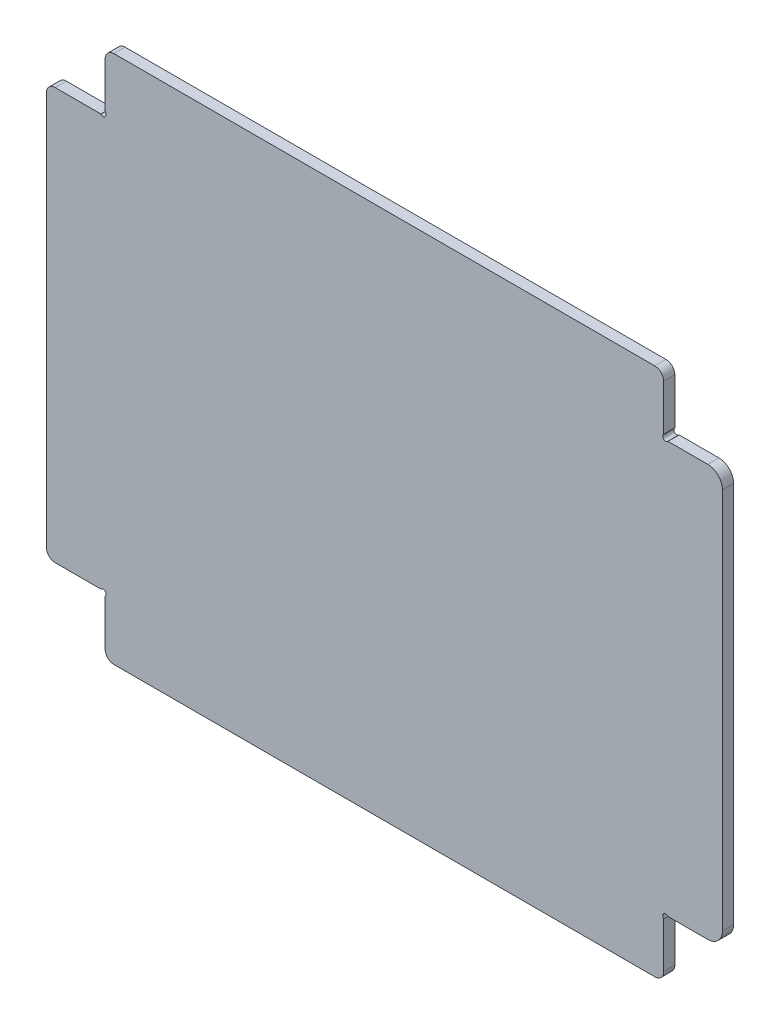
from build123d import *

# Parameters (mm, degrees)
BOSS_EXTRUDE1_DEPTH = 3.8


with BuildPart() as part:
    # Sketch1 → Boss-Extrude1 (new body)
    with BuildSketch(Plane.XY):
        with BuildLine():
            Line((-138.752131357, 112.353936938), (45.247868643, 112.353936938))
            ThreePointArc((45.247868643, 112.353936938), (47.369188986, 111.475257282), (48.247868643, 109.353936938))
            Line((48.247868643, 109.353936938), (48.247868643, 93.711236271))
            ThreePointArc((48.247868643, 93.711236271), (48.261405024, 92.257158628), (49.712321625, 92.353936938))
            Line((49.712321625, 92.353936938), (63.247868643, 92.353936938))
            ThreePointArc((63.247868643, 92.353936938), (66.783402549, 90.889470844), (68.247868643, 87.353936938))
            Line((68.247868643, 87.353936938), (68.247868643, -42.646063062))
            ThreePointArc((68.247868643, -42.646063062), (66.783402549, -46.181596968), (63.247868643, -47.646063062))
            Line((63.247868643, -47.646063062), (49.712321625, -47.646063062))
            ThreePointArc((49.712321625, -47.646063062), (48.261405024, -47.549284752), (48.247868643, -49.003362395))
            Line((48.247868643, -49.003362395), (48.247868643, -64.646063062))
            ThreePointArc((48.247868643, -64.646063062), (47.369188986, -66.767383405), (45.247868643, -67.646063062))
            Line((45.247868643, -67.646063062), (-138.752131357, -67.646063062))
            ThreePointArc((-138.752131357, -67.646063062), (-140.873451701, -66.767383405), (-141.752131357, -64.646063062))
            Line((-141.752131357, -64.646063062), (-141.752131357, -49.003362395))
            ThreePointArc((-141.752131357, -49.003362395), (-141.765667738, -47.549284752), (-143.21658434, -47.646063062))
            Line((-143.21658434, -47.646063062), (-158.752131357, -47.646063062))
            ThreePointArc((-158.752131357, -47.646063062), (-160.873451701, -46.767383405), (-161.752131357, -44.646063062))
            Line((-161.752131357, -44.646063062), (-161.752131357, 89.353936938))
            ThreePointArc((-161.752131357, 89.353936938), (-160.873451701, 91.475257282), (-158.752131357, 92.353936938))
            Line((-158.752131357, 92.353936938), (-143.21658434, 92.353936938))
            ThreePointArc((-143.21658434, 92.353936938), (-141.765667738, 92.257158628), (-141.752131357, 93.711236271))
            Line((-141.752131357, 93.711236271), (-141.752131357, 109.353936938))
            ThreePointArc((-141.752131357, 109.353936938), (-140.873451701, 111.475257282), (-138.752131357, 112.353936938))
        make_face()
    extrude(amount=BOSS_EXTRUDE1_DEPTH)


solid = part.part
